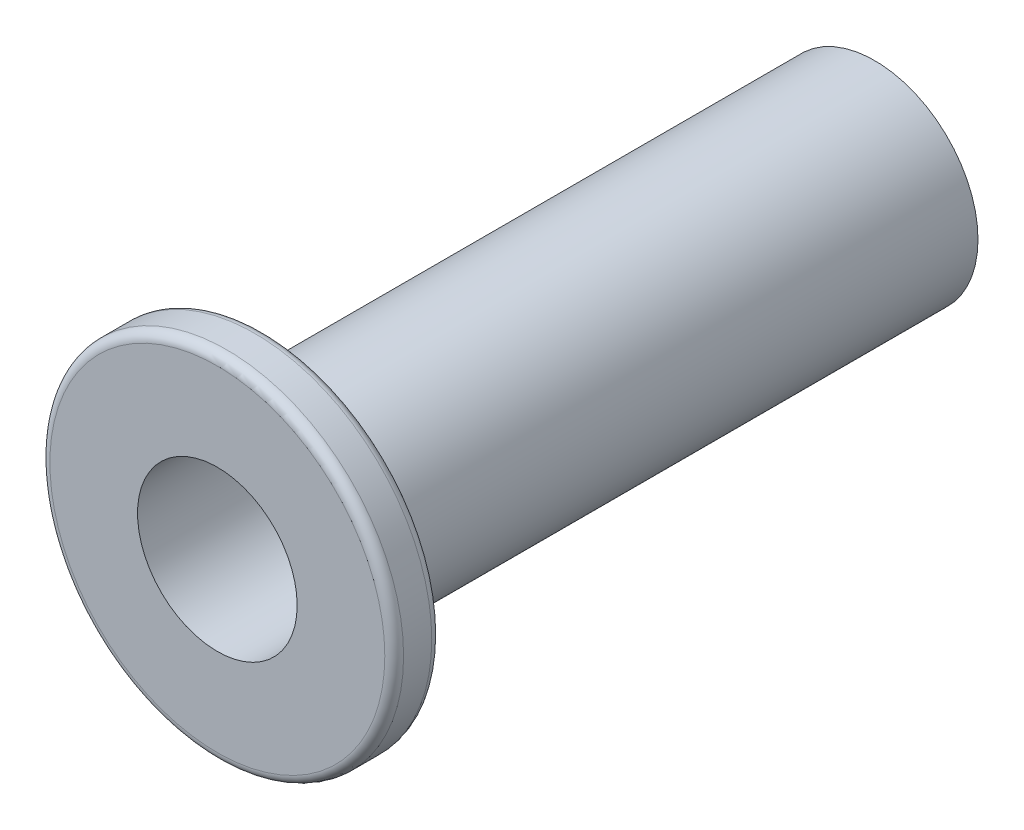
from build123d import *

# Parameters (mm, degrees)
ESBO_O1_R                = 22
ESBO_O1_R_2              = 17
RESSALTO_EXTRUS_O1_DEPTH = 120
ESBO_O2_R                = 37.66512487
ESBO_O2_R_2              = 17
RESSALTO_EXTRUS_O2_DEPTH = 10
FILETE1_R                = 10
FILETE2_R                = 2
RESSALTO_EXTRUS_O3_START = 10
ESBO_O3_R                = 22
RESSALTO_EXTRUS_O3_DEPTH = 10


with BuildPart() as part:
    # Esboço1 → Ressalto-extrusão1 (new body)
    with BuildSketch(Plane.XY):
        Circle(ESBO_O1_R)
        Circle(ESBO_O1_R_2, mode=Mode.SUBTRACT)
    extrude(amount=RESSALTO_EXTRUS_O1_DEPTH)

    # Esboço2 → Ressalto-extrusão2 (add)
    with BuildSketch(Plane.XY.offset(120)):
        Circle(ESBO_O2_R)
        Circle(ESBO_O2_R_2, mode=Mode.SUBTRACT)
    extrude(amount=RESSALTO_EXTRUS_O2_DEPTH)

    # Filete1
    filete1_edges = [part.edges().sort_by_distance(p)[0] for p in [
        (-22, 0, 120),
    ]]
    fillet(filete1_edges, radius=FILETE1_R)

    # Filete2
    filete2_edges = [part.edges().sort_by_distance(p)[0] for p in [
        (-37.66512487, 0, 130),
        (-37.66512487, 0, 120),
    ]]
    fillet(filete2_edges, radius=FILETE2_R)

    # Esboço3 → Ressalto-extrusão3 (add)
    with BuildSketch(Plane(origin=(0, 0, 0), x_dir=(-1, 0, 0), z_dir=(0, 0, -1)).offset(RESSALTO_EXTRUS_O3_START)):
        Circle(ESBO_O3_R)
    extrude(amount=-RESSALTO_EXTRUS_O3_DEPTH)


solid = part.part
